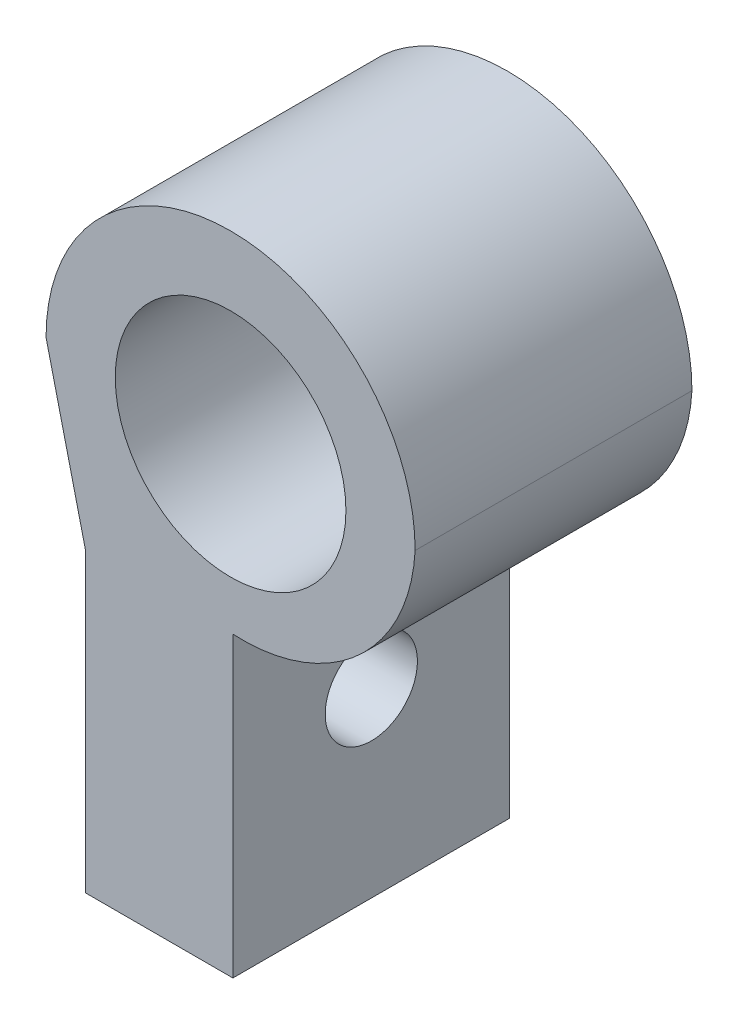
from build123d import *

# Parameters (mm, degrees)
CROQUIS1_R              = 2.5
SALIENTE_EXTRUIR1_DEPTH = 6
CROQUIS4_R              = 1
CORTAR_EXTRUIR2_DEPTH   = 3.2


with BuildPart() as part:
    # Croquis1 → Saliente-Extruir1 (new body)
    with BuildSketch(Plane.XY):
        with BuildLine():
            Line((-3.15, -10), (-3.15, -3.545259156))
            Line((-3.15, -3.545259156), (-4, 0))
            ThreePointArc((-4, 0), (0, 4), (4, 0))
            ThreePointArc((4, 0), (2.759247212, -2.590701364), (0.05, -3.545259156))
            Line((0.05, -3.545259156), (0.05, -10))
            Line((0.05, -10), (-3.15, -10))
        make_face()
        Circle(CROQUIS1_R, mode=Mode.SUBTRACT)
    extrude(amount=SALIENTE_EXTRUIR1_DEPTH)

    # Croquis4 → Cortar-Extruir2 (cut)
    with BuildSketch(Plane(origin=(0.05, 0, 0), x_dir=(0, 0, -1), z_dir=(1, 0, 0))):
        with Locations((-3, -6.050719138)):
            Circle(CROQUIS4_R)
    extrude(amount=-CORTAR_EXTRUIR2_DEPTH, mode=Mode.SUBTRACT)


solid = part.part
